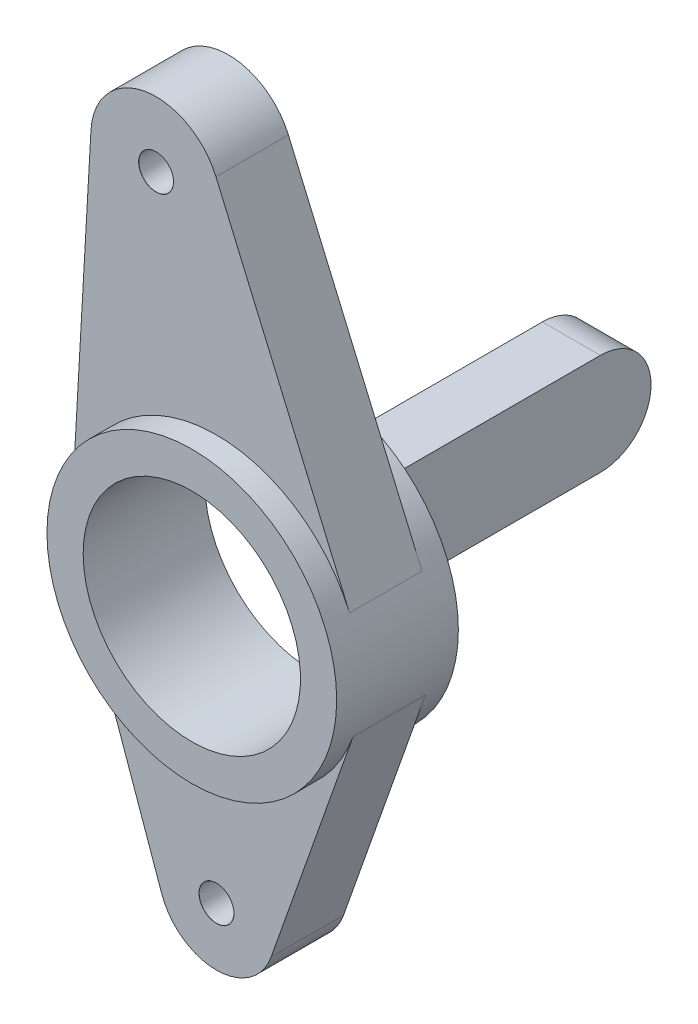
from build123d import *

# Parameters (mm, degrees)
IZIM1_R                         = 50
IZIM1_R_2                       = 37.5
Y_KSEKLIK_EKSTR_ZYON1_DEPTH     = 21
Y_KSEKLIK_EKSTR_ZYON2_DEPTH     = 12.5
Y_KSEKLIK_EKSTR_ZYON6_DEPTH     = 10
F_12_0_12_AP_DELIK2_D           = 12
F_12_0_12_AP_DELIK2_CSINK_D     = 12.05
F_12_0_12_AP_DELIK2_CSINK_ANGLE = 92
F_10_0_10_AP_DELIK1_D           = 10
F_10_0_10_AP_DELIK1_CSINK_D     = 10.05
F_10_0_10_AP_DELIK1_CSINK_ANGLE = 92
KES_EKSTR_ZYON2_DEPTH           = 197.331986088
KES_EKSTR_ZYON2_DEPTH_BACK      = 21
IZIM8_R                         = 37.5
KES_EKSTR_ZYON4_DEPTH           = 197.331986088
KES_EKSTR_ZYON4_DEPTH_BACK      = 22
IZIM9_R                         = 37.5


with BuildPart() as part:
    # Çizim1 → Yükseklik-Ekstrüzyon1 (new, symmetric)
    with BuildSketch(Plane.XY):
        with Locations(Location((0, 0, 0), (0, 0, 180))):
            Circle(IZIM1_R)
        with Locations(Location((0, 0, 0), (0, 0, 180))):
            Circle(IZIM1_R_2, mode=Mode.SUBTRACT)
    extrude(amount=Y_KSEKLIK_EKSTR_ZYON1_DEPTH, both=True)

    # Çizim2 → Yükseklik-Ekstrüzyon2 (add, symmetric)
    with BuildSketch(Plane.XY):
        with BuildLine():
            Line((-43.301638089, 119.45173979), (-49.919681708, 2.832909841))
            ThreePointArc((-49.919681708, 2.832909841), (-49.499755188, -7.055085847), (-47.140452079, -16.666666667))
            Line((-47.140452079, -16.666666667), (-18.856180832, -96.666666667))
            ThreePointArc((-18.856180832, -96.666666667), (0, -110), (18.856180832, -96.666666667))
            Line((18.856180832, -96.666666667), (47.140452079, -16.666666667))
            ThreePointArc((47.140452079, -16.666666667), (49.972845482, 1.647639043), (45.940244303, 19.735601166))
            Line((45.940244303, 19.735601166), (-0.164671384, 127.057950886))
            ThreePointArc((-0.164671384, 127.057950886), (-24.744865318, 140.335104804), (-43.301638089, 119.45173979))
        make_face()
    extrude(amount=Y_KSEKLIK_EKSTR_ZYON2_DEPTH, both=True)

    # Çizim3 → Yükseklik-Ekstrüzyon6 (add, symmetric)
    with BuildSketch(Plane(origin=(0, 0, 0), x_dir=(0, 0, -1), z_dir=(1, 0, 0))):
        with BuildLine():
            Line((110, -17.5), (5.069368948, -17.5))
            Line((5.069368948, -17.5), (5.069368948, 17.5))
            Line((5.069368948, 17.5), (110, 17.5))
            ThreePointArc((110, 17.5), (127.5, 0), (110, -17.5))
        make_face()
    extrude(amount=Y_KSEKLIK_EKSTR_ZYON6_DEPTH, both=True)

    # Ø12.0 (12) Çap Delik2 (through all)
    with Locations(Plane(origin=(-20.83778132, 118.176930361, 12.5), x_dir=(1, 0, 0), z_dir=(0, 0, 1))):
        with Locations((0, 0), (20.83778132, -208.176930361)):
            CounterSinkHole(F_12_0_12_AP_DELIK2_D / 2, F_12_0_12_AP_DELIK2_CSINK_D / 2, counter_sink_angle=F_12_0_12_AP_DELIK2_CSINK_ANGLE)

    # Ø10.0 (10) Çap Delik1 (through all)
    with Locations(Plane.XY.offset(21)):
        with Locations((0, 0)):
            CounterSinkHole(F_10_0_10_AP_DELIK1_D / 2, F_10_0_10_AP_DELIK1_CSINK_D / 2, counter_sink_angle=F_10_0_10_AP_DELIK1_CSINK_ANGLE)

    # Çizim8 → Kes-Ekstrüzyon2 (cut, two sides: drawn at the far end of the back side and taken through both)
    with BuildSketch(Plane.XY.offset(-KES_EKSTR_ZYON2_DEPTH_BACK)):
        with Locations(Location((0, 0, 0), (0, 0, 180))):
            Circle(IZIM8_R)
    extrude(amount=KES_EKSTR_ZYON2_DEPTH + KES_EKSTR_ZYON2_DEPTH_BACK, mode=Mode.SUBTRACT)


with BuildPart() as kes_ekstr_zyon2_piece_1:
    # of the separate pieces the step leaves, piece 1, a body of its own (kes_ekstr_zyon2_pieces)
    add(part.part.solids().sort_by_distance((-50, 0, -21))[0])


with BuildPart() as kes_ekstr_zyon2_piece_2:
    # of the separate pieces the step leaves, piece 2, a body of its own (kes_ekstr_zyon2_pieces)
    add(part.part.solids().sort_by_distance((10, 17.5, -21))[0])

    # Çizim9 → Kes-Ekstrüzyon4 (cut, two sides: drawn at the far end of the back side and taken through both)
    with BuildSketch(Plane.XY.offset(-KES_EKSTR_ZYON4_DEPTH_BACK)):
        with Locations(Location((0, 0, 0), (0, 0, 180))):
            Circle(IZIM9_R)
    extrude(amount=KES_EKSTR_ZYON4_DEPTH + KES_EKSTR_ZYON4_DEPTH_BACK, mode=Mode.SUBTRACT)


solid = Compound([kes_ekstr_zyon2_piece_1.part, kes_ekstr_zyon2_piece_2.part])
